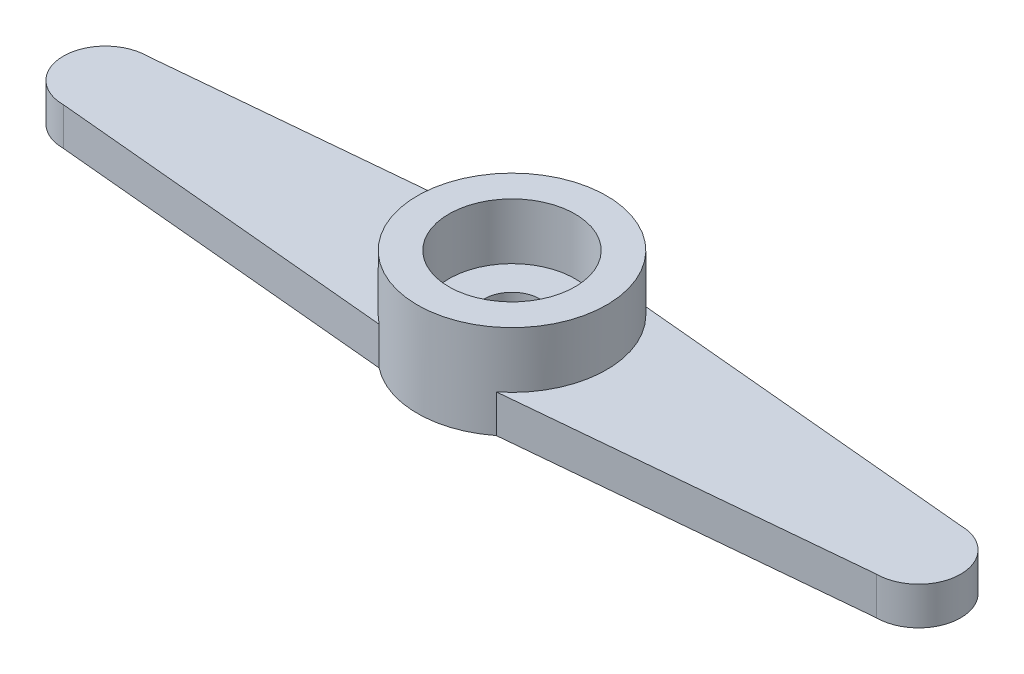
from build123d import *

# Parameters (mm, degrees)
SCHIZZO1_R                   = 3.375
ESTRUSIONE_ESTRUSIONE1_DEPTH = 1.35
SCHIZZO2_R                   = 3.375
ESTRUSIONE_ESTRUSIONE2_DEPTH = 2
SCHIZZO3_R                   = 2.25
TAGLIO_ESTRUSIONE1_DEPTH     = 2
SCHIZZO4_R                   = 1
TAGLIO_ESTRUSIONE2_DEPTH     = 17.47393775


with BuildPart() as part:
    # Schizzo1 → Estrusione-Estrusione1 (new body)
    with BuildSketch(Plane(origin=(0, 0, 0), x_dir=(1, 0, 0), z_dir=(0, 1, 0))):
        Circle(SCHIZZO1_R)
        with BuildLine():
            Line((-2.090005981, 2.65), (-14.5, 1.5))
            ThreePointArc((-14.5, 1.5), (-16, 0), (-14.5, -1.5))
            Line((-14.5, -1.5), (-2.090005981, -2.65))
            Line((-2.090005981, -2.65), (-2.090005981, 2.65))
        make_face()
        with BuildLine():
            Line((2.090005981, 2.65), (2.090005981, -2.65))
            Line((2.090005981, -2.65), (14.5, -1.5))
            ThreePointArc((14.5, -1.5), (16, 0), (14.5, 1.5))
            Line((14.5, 1.5), (2.090005981, 2.65))
        make_face()
    extrude(amount=ESTRUSIONE_ESTRUSIONE1_DEPTH)

    # Schizzo2 → Estrusione-Estrusione2 (add)
    with BuildSketch(Plane(origin=(0, 1.35, 0), x_dir=(1, 0, 0), z_dir=(0, 1, 0))):
        with Locations(Location((0, 0, 0), (0, 0, 128.262191128))):
            Circle(SCHIZZO2_R)
    extrude(amount=ESTRUSIONE_ESTRUSIONE2_DEPTH)

    # Schizzo3 → Taglio-Estrusione1 (cut)
    with BuildSketch(Plane(origin=(0, 3.35, 0), x_dir=(1, 0, 0), z_dir=(0, 1, 0))):
        with Locations(Location((0, 0, 0), (0, 0, 270))):
            Circle(SCHIZZO3_R)
    extrude(amount=-TAGLIO_ESTRUSIONE1_DEPTH, mode=Mode.SUBTRACT)

    # Schizzo4 → Taglio-Estrusione2 (cut, through all)
    with BuildSketch(Plane(origin=(0, 1.35, 0), x_dir=(1, 0, 0), z_dir=(0, 1, 0))):
        with Locations(Location((0, 0, 0), (0, 0, 270))):
            Circle(SCHIZZO4_R)
    extrude(amount=-TAGLIO_ESTRUSIONE2_DEPTH, mode=Mode.SUBTRACT)


solid = part.part
